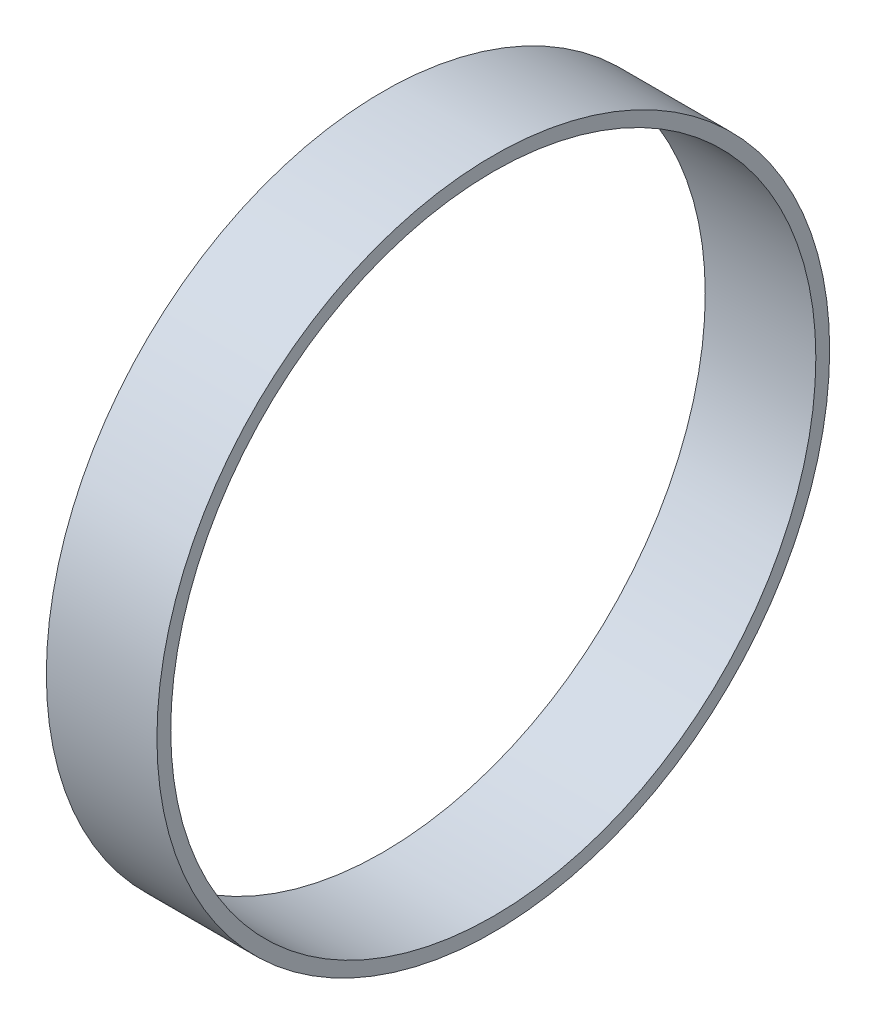
from build123d import *

# Parameters (mm, degrees)
SKETCH1_R           = 36.5
SKETCH1_R_2         = 35
BOSS_EXTRUDE1_DEPTH = 12


with BuildPart() as part:
    # Sketch1 → Boss-Extrude1 (new body)
    with BuildSketch(Plane(origin=(0, 0, 0), x_dir=(0, 0, -1), z_dir=(1, 0, 0))):
        with Locations((-28.542888787, 22.115407884)):
            Circle(SKETCH1_R)
        with Locations((-28.542888787, 22.115407884)):
            Circle(SKETCH1_R_2, mode=Mode.SUBTRACT)
    extrude(amount=BOSS_EXTRUDE1_DEPTH)


solid = part.part
